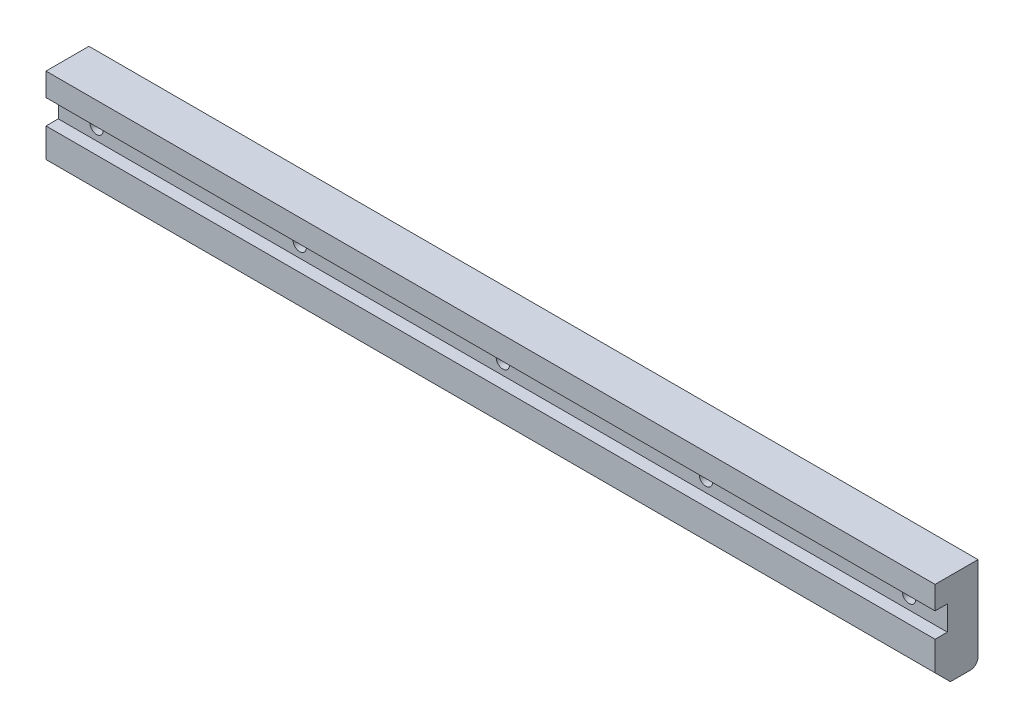
from build123d import *

# Parameters (mm, degrees)
EXTRUDE_1_DEPTH        = 290
EXTRUDE_1_DEPTH_BACK   = 290
PATTERN_LINEAR_1_COUNT = 5
PATTERN_LINEAR_1_PITCH = 132.5
FILLET_1_R             = 5


with BuildPart() as part:
    # 草圖1 → 擠出1 (new, two sides: drawn at the far end of the back side and taken through both)
    with BuildSketch(Plane.YZ.offset(-EXTRUDE_1_DEPTH_BACK)):
        Polygon((0, 0), (60, 0), (60, 28), (45, 28), (45, 20), (29, 20), (29, 28), (10, 28), (0, 18), align=None)
    extrude(amount=EXTRUDE_1_DEPTH + EXTRUDE_1_DEPTH_BACK)

    # 草圖2 → 孔1 (revolve, cut)
    with BuildSketch(Plane(origin=(-265, 37, 20), x_dir=(0, -1, 0), z_dir=(1, 0, 0))):
        Polygon((0, 0), (0, 52.597820886), (4.3235, 50), (4.3235, 0), align=None)
    hole_wizard_1 = revolve(axis=Axis((-265, 37, 24.244199587), (0, 0, -1)), mode=Mode.SUBTRACT)

    # 矩形陣列1: 孔1 ×5
    with Locations(*[(i * PATTERN_LINEAR_1_PITCH, 0, 0) for i in range(1, PATTERN_LINEAR_1_COUNT)]):
        add(hole_wizard_1, mode=Mode.SUBTRACT)

    # 圓角1
    fillet_1_edges = [part.edges().sort_by_distance(p)[0] for p in [
        (0, 0, 0),
    ]]
    fillet(fillet_1_edges, radius=FILLET_1_R)


solid = part.part
